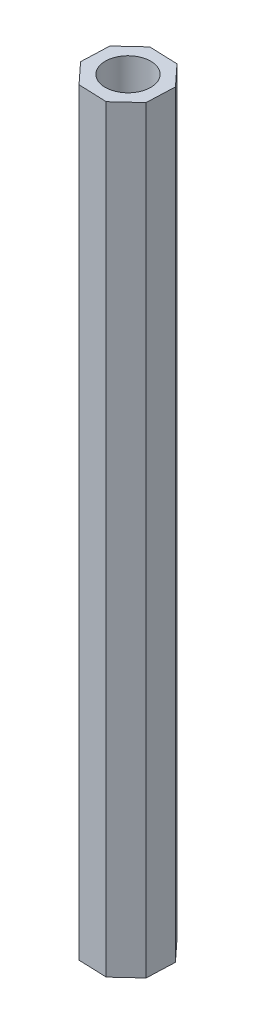
from build123d import *

# Parameters (mm, degrees)
SKETCH1_R           = 1.5
BOSS_EXTRUDE1_DEPTH = 50


with BuildPart() as part:
    # Sketch1 → Boss-Extrude1 (new body)
    with BuildSketch(Plane(origin=(0, 0, 0), x_dir=(1, 0, 0), z_dir=(0, 1, 0))):
        Polygon((2.284207107, 0.844680753), (1.017898846, 2.212457823), (-0.844680753, 2.284207107), (-2.212457823, 1.017898846), (-2.284207107, -0.844680753), (-1.017898846, -2.212457823), (0.844680753, -2.284207107), (2.212457823, -1.017898846), align=None)
        with Locations(Location((0, 0, 0), (0, 0, 270))):
            Circle(SKETCH1_R, mode=Mode.SUBTRACT)
    extrude(amount=BOSS_EXTRUDE1_DEPTH)


solid = part.part
